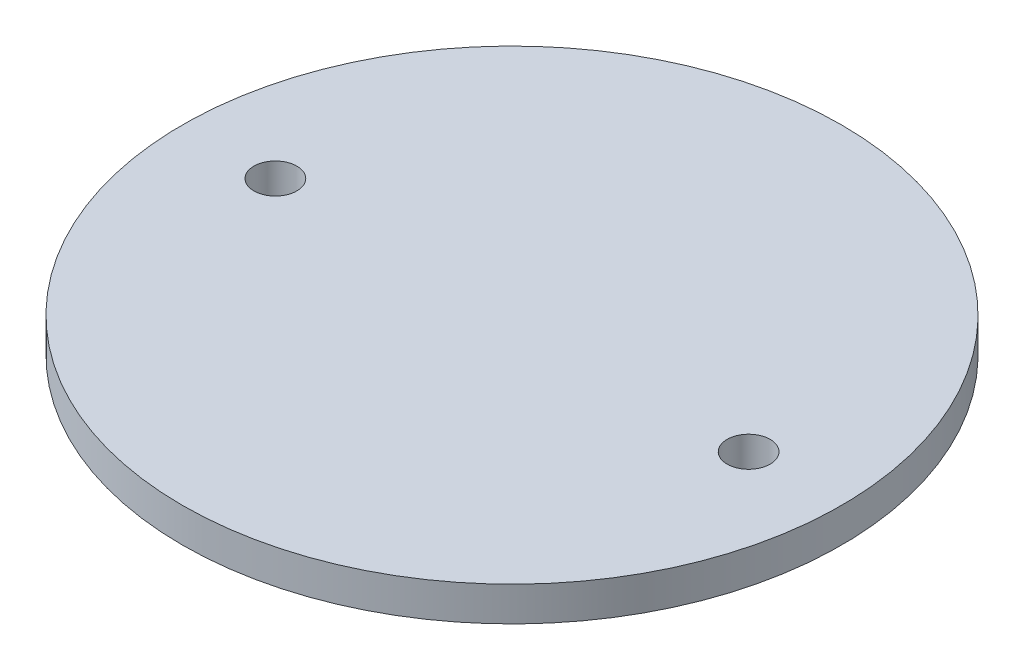
from build123d import *

# Parameters (mm, degrees)
SKETCH1_R           = 38.3
SKETCH1_R_2         = 2.5
BOSS_EXTRUDE1_DEPTH = 4


with BuildPart() as part:
    # Sketch1 → Boss-Extrude1 (new body)
    with BuildSketch(Plane(origin=(0, 0, 0), x_dir=(1, 0, 0), z_dir=(0, 1, 0))):
        with Locations(Location((0, 0, 0), (0, 0, 270))):
            Circle(SKETCH1_R)
        with Locations(Location((-27.5, 0, 0), (0, 0, 270))):
            Circle(SKETCH1_R_2, mode=Mode.SUBTRACT)
        with Locations(Location((27.5, 0, 0), (0, 0, 270))):
            Circle(SKETCH1_R_2, mode=Mode.SUBTRACT)
    extrude(amount=BOSS_EXTRUDE1_DEPTH)


solid = part.part
